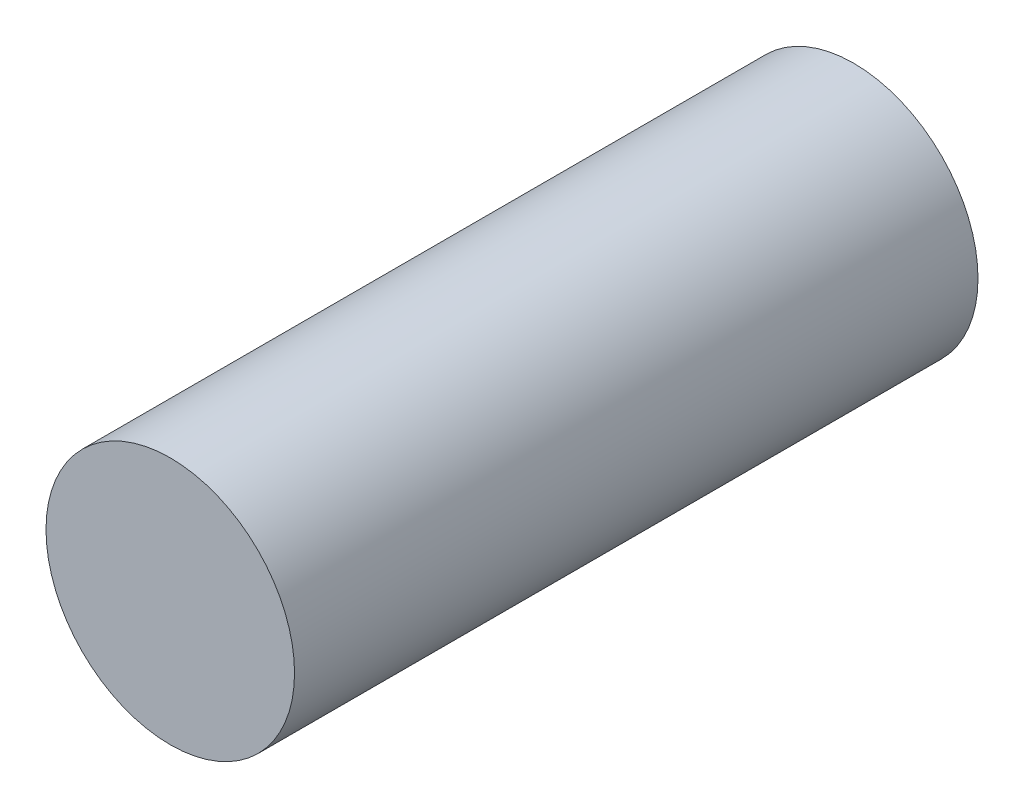
from build123d import *

# Parameters (mm, degrees)
SKETCH1_R           = 2
BOSS_EXTRUDE1_DEPTH = 11


with BuildPart() as part:
    # Sketch1 → Boss-Extrude1 (new body)
    with BuildSketch(Plane.XY):
        Circle(SKETCH1_R)
    extrude(amount=BOSS_EXTRUDE1_DEPTH)


solid = part.part
